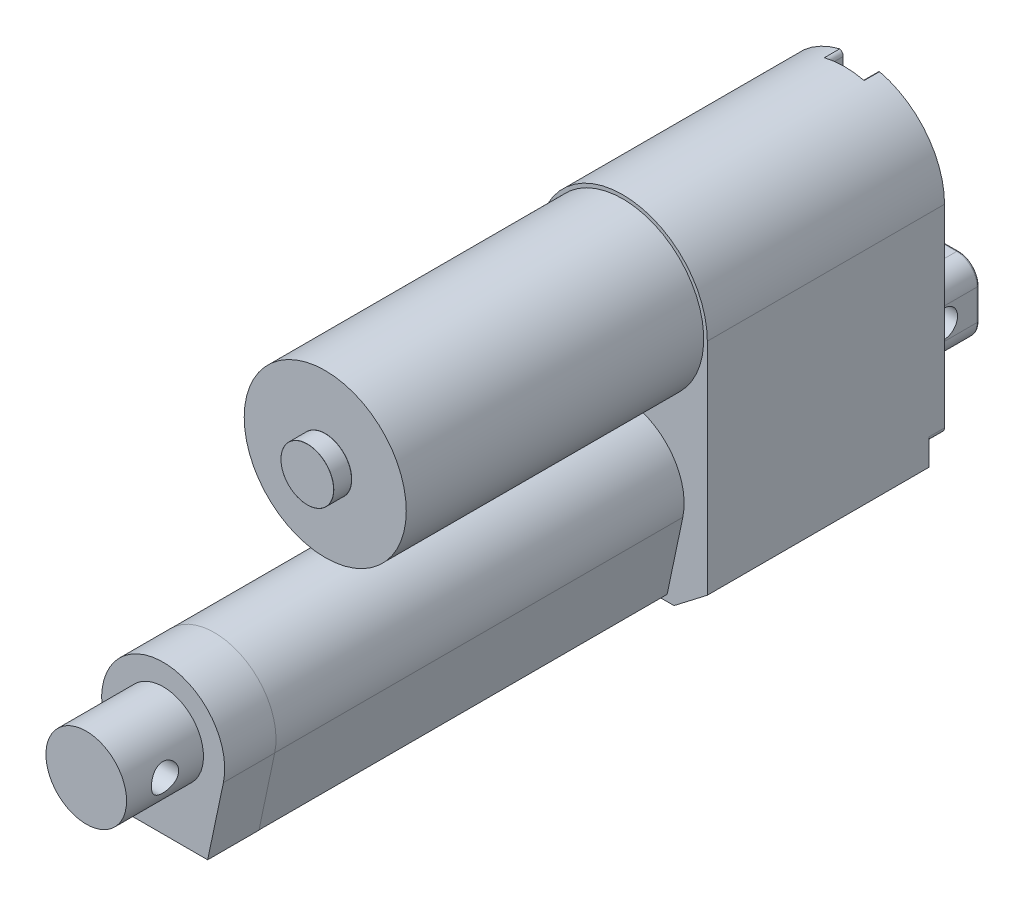
from build123d import *

# Parameters (mm, degrees)
BOSS_EXTRUDE1_DEPTH                      = 58.7375
SKETCH2_R                                = 20.066
BOSS_EXTRUDE2_DEPTH                      = 73.66
EDIT_LENGTH_HERE_HOVER_FOR_COMMENT_DEPTH = 113.792
SKETCH4_R                                = 9.9822
BOSS_EXTRUDE4_DEPTH                      = 19.05
BOSS_EXTRUDE5_DEPTH                      = 20.6502
CUT_EXTRUDE3_DEPTH                       = 211.434564151
CUT_EXTRUDE3_DEPTH_BACK                  = 211.434564151
SKETCH6_R                                = 3.3782
FILLET1_R                                = 2.54
FILLET2_R                                = 0.508
CUT_EXTRUDE5_DEPTH                       = 3.81
SKETCH8_R                                = 6.5405
BOSS_EXTRUDE6_DEPTH                      = 4.445
FILLET3_R                                = 0.0254
BOSS_EXTRUDE7_START                      = -12.7
BOSS_EXTRUDE7_DEPTH                      = 12.7
SKETCH10_R                               = 2.54
BOSS_EXTRUDE8_DEPTH                      = 0.635


with BuildPart() as part:
    # Sketch1 → Boss-Extrude1 (new body)
    with BuildSketch(Plane.XY):
        with BuildLine():
            Line((-12.7, 0), (12.7, 0))
            Line((12.7, 0), (20.955, 6.35))
            Line((20.955, 6.35), (20.955, 60.833))
            ThreePointArc((20.955, 60.833), (0, 81.788), (-20.955, 60.833))
            Line((-20.955, 60.833), (-20.955, 6.35))
            Line((-20.955, 6.35), (-12.7, 0))
        make_face()
    extrude(amount=BOSS_EXTRUDE1_DEPTH)

    # Sketch2 → Boss-Extrude2 (add)
    with BuildSketch(Plane.XY.offset(58.7375)):
        with Locations(Location((0, 60.833, 0), (0, 0, 180))):
            Circle(SKETCH2_R)
    extrude(amount=BOSS_EXTRUDE2_DEPTH)

    # Sketch3 → EDIT_LENGTH_HERE (hover for comment) (add)
    with BuildSketch(Plane.XY.offset(58.7375)):
        with BuildLine():
            Line((-14.88814822, 20.042680112), (-10.996912775, 1.5621))
            Line((-10.996912775, 1.5621), (10.996912775, 1.5621))
            Line((10.996912775, 1.5621), (14.88814822, 20.042680112))
            ThreePointArc((14.88814822, 20.042680112), (0, 38.3921), (-14.88814822, 20.042680112))
        make_face()
    extrude(amount=EDIT_LENGTH_HERE_HOVER_FOR_COMMENT_DEPTH)

    # Sketch4 → Boss-Extrude4 (add)
    with BuildSketch(Plane.XY.offset(172.5295)):
        with Locations(Location((0, 23.1775, 0), (0, 0, 180))):
            Circle(SKETCH4_R)
    extrude(amount=BOSS_EXTRUDE4_DEPTH)

    # Sketch5 → Boss-Extrude5 (add)
    with BuildSketch(Plane(origin=(0, 0, 0), x_dir=(-1, 0, 0), z_dir=(0, 0, -1))):
        with BuildLine():
            Line((-3.81, 32.0675), (3.81, 32.0675))
            ThreePointArc((3.81, 32.0675), (7.402102448, 30.579602448), (8.89, 26.9875))
            Line((8.89, 26.9875), (8.89, 19.3675))
            ThreePointArc((8.89, 19.3675), (7.402102448, 15.775397552), (3.81, 14.2875))
            Line((3.81, 14.2875), (-3.81, 14.2875))
            ThreePointArc((-3.81, 14.2875), (-7.402102448, 15.775397552), (-8.89, 19.3675))
            Line((-8.89, 19.3675), (-8.89, 26.9875))
            ThreePointArc((-8.89, 26.9875), (-7.402102448, 30.579602448), (-3.81, 32.0675))
        make_face()
    extrude(amount=BOSS_EXTRUDE5_DEPTH)

    # Sketch6 → Cut-Extrude3 (cut, two sides: drawn at the far end of the back side and taken through both)
    with BuildSketch(Plane(origin=(8.89, 0, 0), x_dir=(0, 0, -1), z_dir=(1, 0, 0)).offset(-CUT_EXTRUDE3_DEPTH_BACK)):
        with Locations((11.90625, 23.1775)):
            Circle(SKETCH6_R)
        with Locations(Location((-182.0545, 23.1775, 0), (0, 0, 179.999999986))):
            Circle(SKETCH6_R)
    extrude(amount=CUT_EXTRUDE3_DEPTH + CUT_EXTRUDE3_DEPTH_BACK, mode=Mode.SUBTRACT)

    # Fillet1
    fillet1_edges = [part.edges().sort_by_distance(p)[0] for p in [
        (7.402102448, 15.775397552, 0),
        (0, 14.2875, 0),
        (-7.402102448, 15.775397552, 0),
        (-8.89, 23.1775, 0),
        (-7.402102448, 30.579602448, 0),
        (0, 32.0675, 0),
        (7.402102448, 30.579602448, 0),
        (8.89, 23.1775, 0),
    ]]
    fillet(fillet1_edges, radius=FILLET1_R)

    # Fillet2
    fillet2_edges = [part.edges().sort_by_distance(p)[0] for p in [
        (7.402102448, 15.775397552, -20.6502),
        (0, 14.2875, -20.6502),
        (-7.402102448, 15.775397552, -20.6502),
        (-8.89, 23.1775, -20.6502),
        (-7.402102448, 30.579602448, -20.6502),
        (0, 32.0675, -20.6502),
        (7.402102448, 30.579602448, -20.6502),
        (8.89, 23.1775, -20.6502),
    ]]
    fillet(fillet2_edges, radius=FILLET2_R)

    # Sketch7 → Cut-Extrude5 (cut)
    with BuildSketch(Plane(origin=(0, 0, 0), x_dir=(-1, 0, 0), z_dir=(0, 0, -1))):
        with BuildLine():
            Line((-4.1275, 80.068311519), (-4.1275, 77.089))
            ThreePointArc((-4.1275, 77.089), (0, 72.9615), (4.1275, 77.089))
            Line((4.1275, 77.089), (4.1275, 79.978628931))
            ThreePointArc((4.1275, 79.978628931), (4.367379625, 80.721429048), (4.996400809, 81.183626623))
            ThreePointArc((4.996400809, 81.183626623), (0.071861599, 81.787876781), (-4.856706104, 81.217416372))
            ThreePointArc((-4.856706104, 81.217416372), (-4.325187488, 80.748786262), (-4.1275, 80.068311519))
        make_face()
        with BuildLine():
            ThreePointArc((-19.685, 11.610879552), (-20.583025612, 11.98285394), (-20.955, 12.880879552))
            Line((-20.955, 12.880879552), (-20.955, 6.35))
            Line((-20.955, 6.35), (-13.042377801, 0.26336754))
            ThreePointArc((-13.042377801, 0.26336754), (-13.507857108, 0.994743297), (-13.395607029, 1.854383572))
            Line((-13.395607029, 1.854383572), (-11.222314297, 6.047728836))
            ThreePointArc((-11.222314297, 6.047728836), (-11.349573436, 9.780348644), (-14.605, 11.610879552))
            Line((-14.605, 11.610879552), (-19.685, 11.610879552))
        make_face()
        with BuildLine():
            Line((20.955, 6.35), (20.955, 12.880879552))
            ThreePointArc((20.955, 12.880879552), (20.583025612, 11.98285394), (19.685, 11.610879552))
            Line((19.685, 11.610879552), (14.605, 11.610879552))
            ThreePointArc((14.605, 11.610879552), (11.203032914, 9.51631534), (11.541558483, 5.535614431))
            Line((11.541558483, 5.535614431), (13.402295436, 1.841293477))
            ThreePointArc((13.402295436, 1.841293477), (13.506243345, 0.987572709), (13.042377827, 0.263367559))
            Line((13.042377827, 0.263367559), (20.955, 6.35))
        make_face()
    extrude(amount=-CUT_EXTRUDE5_DEPTH, mode=Mode.SUBTRACT)

    # Sketch8 → Boss-Extrude6 (add)
    with BuildSketch(Plane.XY.offset(132.3975)):
        with Locations((0, 60.833)):
            Circle(SKETCH8_R)
    extrude(amount=BOSS_EXTRUDE6_DEPTH)

    # Fillet3
    fillet3_edges = [part.edges().sort_by_distance(p)[0] for p in [
        (-6.5405, 60.833, 132.3975),
        (-6.5405, 60.833, 136.8425),
    ]]
    fillet(fillet3_edges, radius=FILLET3_R)

    # Sketch9 → Boss-Extrude7 (add)
    with BuildSketch(Plane.XY.offset(172.5295).offset(BOSS_EXTRUDE7_START)):
        with BuildLine():
            Line((-11.017521545, 1.5367), (11.017521545, 1.5367))
            Line((11.017521545, 1.5367), (14.913003226, 20.03744669))
            ThreePointArc((14.913003226, 20.03744669), (0, 38.4175), (-14.913003226, 20.03744669))
            Line((-14.913003226, 20.03744669), (-11.017521545, 1.5367))
        make_face()
        with BuildLine():
            Line((10.996912775, 1.5621), (14.88814822, 20.042680112))
            ThreePointArc((14.88814822, 20.042680112), (0, 38.3921), (-14.88814822, 20.042680112))
            Line((-14.88814822, 20.042680112), (-10.996912775, 1.5621))
            Line((-10.996912775, 1.5621), (10.996912775, 1.5621))
        make_face(mode=Mode.SUBTRACT)
    extrude(amount=BOSS_EXTRUDE7_DEPTH)

    # Sketch10 → Boss-Extrude8 (add)
    with BuildSketch(Plane(origin=(0, 0, 3.81), x_dir=(-1, 0, 0), z_dir=(0, 0, -1))):
        with Locations((0, 77.089)):
            Circle(SKETCH10_R)
        with Locations((-14.605, 7.800879552)):
            Circle(SKETCH10_R)
        with Locations((14.605, 7.800879552)):
            Circle(SKETCH10_R)
    extrude(amount=BOSS_EXTRUDE8_DEPTH)


solid = part.part
